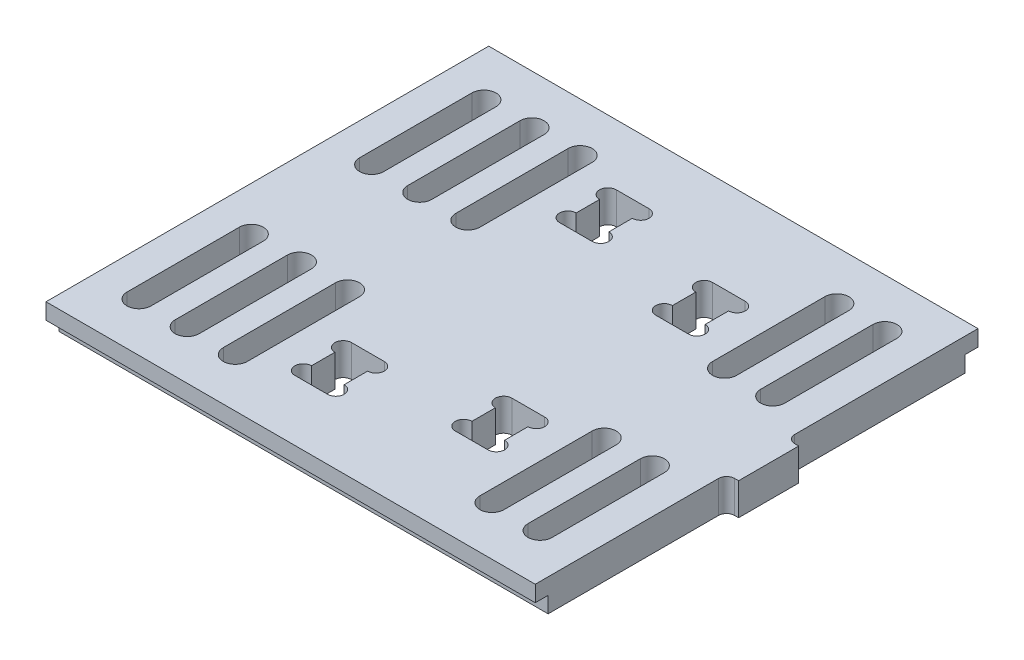
from build123d import *

# Parameters (mm, degrees)
SKETCH1_W           = 175.26
SKETCH1_H           = 12.7
BOSS_EXTRUDE1_DEPTH = 96.8375
SKETCH2_W           = 5.08
SKETCH2_H           = 6.35
CUT_EXTRUDE1_DEPTH  = 213.67191875
CUT_EXTRUDE2_DEPTH  = 132.216646453
CUT_EXTRUDE3_DEPTH  = 132.216646453
SKETCH5_W           = 4.7625
SKETCH5_H           = 23.8125
BOSS_EXTRUDE2_DEPTH = 12.7
FILLET1_R           = 3.175


with BuildPart() as part:
    # Sketch1 → Boss-Extrude1 (new, symmetric)
    with BuildSketch(Plane(origin=(0, 0, 0), x_dir=(0, 0, -1), z_dir=(1, 0, 0))):
        Rectangle(SKETCH1_W, SKETCH1_H)
    extrude(amount=BOSS_EXTRUDE1_DEPTH, both=True)

    # Sketch2 → Cut-Extrude1 (cut, through all)
    with BuildSketch(Plane(origin=(96.8375, 0, 0), x_dir=(0, 0, -1), z_dir=(1, 0, 0))):
        with Locations((-85.09, -3.175)):
            Rectangle(SKETCH2_W, SKETCH2_H)
        with Locations((85.09, -3.175)):
            Rectangle(SKETCH2_W, SKETCH2_H)
    extrude(amount=-CUT_EXTRUDE1_DEPTH, mode=Mode.SUBTRACT)

    # Sketch3 → Cut-Extrude2 (cut, through all)
    with BuildSketch(Plane(origin=(0, 6.35, 0), x_dir=(1, 0, 0), z_dir=(0, 1, 0))):
        with BuildLine():
            Line((28.448, -28.448), (41.402, -28.448))
            ThreePointArc((41.402, -28.448), (44.704, -31.75), (41.402, -35.052))
            Line((41.402, -35.052), (41.402, -44.323))
            ThreePointArc((41.402, -44.323), (44.704, -47.625), (41.402, -50.927))
            Line((41.402, -50.927), (28.448, -50.927))
            ThreePointArc((28.448, -50.927), (25.146, -47.625), (28.448, -44.323))
            Line((28.448, -44.323), (28.448, -35.052))
            ThreePointArc((28.448, -35.052), (25.146, -31.75), (28.448, -28.448))
        make_face()
        with BuildLine():
            Line((-22.352, -41.148), (-9.398, -41.148))
            ThreePointArc((-9.398, -41.148), (-6.096, -44.45), (-9.398, -47.752))
            Line((-9.398, -47.752), (-9.398, -57.023))
            ThreePointArc((-9.398, -57.023), (-6.096, -60.325), (-9.398, -63.627))
            Line((-9.398, -63.627), (-22.352, -63.627))
            ThreePointArc((-22.352, -63.627), (-25.654, -60.325), (-22.352, -57.023))
            Line((-22.352, -57.023), (-22.352, -47.752))
            ThreePointArc((-22.352, -47.752), (-25.654, -44.45), (-22.352, -41.148))
        make_face()
        with BuildLine():
            Line((-9.398, 47.752), (-9.398, 57.023))
            ThreePointArc((-9.398, 57.023), (-6.096, 60.325), (-9.398, 63.627))
            Line((-9.398, 63.627), (-22.352, 63.627))
            ThreePointArc((-22.352, 63.627), (-25.654, 60.325), (-22.352, 57.023))
            Line((-22.352, 57.023), (-22.352, 47.752))
            ThreePointArc((-22.352, 47.752), (-25.654, 44.45), (-22.352, 41.148))
            Line((-22.352, 41.148), (-9.398, 41.148))
            ThreePointArc((-9.398, 41.148), (-6.096, 44.45), (-9.398, 47.752))
        make_face()
        with BuildLine():
            Line((41.402, 35.052), (41.402, 44.323))
            ThreePointArc((41.402, 44.323), (44.704, 47.625), (41.402, 50.927))
            Line((41.402, 50.927), (28.448, 50.927))
            ThreePointArc((28.448, 50.927), (25.146, 47.625), (28.448, 44.323))
            Line((28.448, 44.323), (28.448, 35.052))
            ThreePointArc((28.448, 35.052), (25.146, 31.75), (28.448, 28.448))
            Line((28.448, 28.448), (41.402, 28.448))
            ThreePointArc((41.402, 28.448), (44.704, 31.75), (41.402, 35.052))
        make_face()
    extrude(amount=-CUT_EXTRUDE2_DEPTH, mode=Mode.SUBTRACT)

    # Sketch4 → Cut-Extrude3 (cut, through all)
    with BuildSketch(Plane(origin=(0, 6.35, 0), x_dir=(1, 0, 0), z_dir=(0, 1, 0))):
        with BuildLine():
            Line((55.5625, -68.2625), (55.5625, -23.8125))
            ThreePointArc((55.5625, -23.8125), (60.325, -19.05), (65.0875, -23.8125))
            Line((65.0875, -23.8125), (65.0875, -68.2625))
            ThreePointArc((65.0875, -68.2625), (60.325, -73.025), (55.5625, -68.2625))
        make_face()
        with BuildLine():
            Line((55.5625, 23.8125), (55.5625, 68.2625))
            ThreePointArc((55.5625, 68.2625), (60.325, 73.025), (65.0875, 68.2625))
            Line((65.0875, 68.2625), (65.0875, 23.8125))
            ThreePointArc((65.0875, 23.8125), (60.325, 19.05), (55.5625, 23.8125))
        make_face()
        with BuildLine():
            Line((84.1375, 68.2625), (84.1375, 23.8125))
            ThreePointArc((84.1375, 23.8125), (79.375, 19.05), (74.6125, 23.8125))
            Line((74.6125, 23.8125), (74.6125, 68.2625))
            ThreePointArc((74.6125, 68.2625), (79.375, 73.025), (84.1375, 68.2625))
        make_face()
        with BuildLine():
            Line((84.1375, -23.8125), (84.1375, -68.2625))
            ThreePointArc((84.1375, -68.2625), (79.375, -73.025), (74.6125, -68.2625))
            Line((74.6125, -68.2625), (74.6125, -23.8125))
            ThreePointArc((74.6125, -23.8125), (79.375, -19.05), (84.1375, -23.8125))
        make_face()
        with BuildLine():
            Line((-84.1375, -68.2625), (-84.1375, -23.8125))
            ThreePointArc((-84.1375, -23.8125), (-79.375, -19.05), (-74.6125, -23.8125))
            Line((-74.6125, -23.8125), (-74.6125, -68.2625))
            ThreePointArc((-74.6125, -68.2625), (-79.375, -73.025), (-84.1375, -68.2625))
        make_face()
        with BuildLine():
            Line((-84.1375, 23.8125), (-84.1375, 68.2625))
            ThreePointArc((-84.1375, 68.2625), (-79.375, 73.025), (-74.6125, 68.2625))
            Line((-74.6125, 68.2625), (-74.6125, 23.8125))
            ThreePointArc((-74.6125, 23.8125), (-79.375, 19.05), (-84.1375, 23.8125))
        make_face()
        with BuildLine():
            Line((-65.0875, -68.2625), (-65.0875, -23.8125))
            ThreePointArc((-65.0875, -23.8125), (-60.325, -19.05), (-55.5625, -23.8125))
            Line((-55.5625, -23.8125), (-55.5625, -68.2625))
            ThreePointArc((-55.5625, -68.2625), (-60.325, -73.025), (-65.0875, -68.2625))
        make_face()
        with BuildLine():
            Line((-65.0875, 23.8125), (-65.0875, 68.2625))
            ThreePointArc((-65.0875, 68.2625), (-60.325, 73.025), (-55.5625, 68.2625))
            Line((-55.5625, 68.2625), (-55.5625, 23.8125))
            ThreePointArc((-55.5625, 23.8125), (-60.325, 19.05), (-65.0875, 23.8125))
        make_face()
        with BuildLine():
            Line((-46.0375, -68.2625), (-46.0375, -23.8125))
            ThreePointArc((-46.0375, -23.8125), (-41.275, -19.05), (-36.5125, -23.8125))
            Line((-36.5125, -23.8125), (-36.5125, -68.2625))
            ThreePointArc((-36.5125, -68.2625), (-41.275, -73.025), (-46.0375, -68.2625))
        make_face()
        with BuildLine():
            Line((-46.0375, 23.8125), (-46.0375, 68.2625))
            ThreePointArc((-46.0375, 68.2625), (-41.275, 73.025), (-36.5125, 68.2625))
            Line((-36.5125, 68.2625), (-36.5125, 23.8125))
            ThreePointArc((-36.5125, 23.8125), (-41.275, 19.05), (-46.0375, 23.8125))
        make_face()
    extrude(amount=-CUT_EXTRUDE3_DEPTH, mode=Mode.SUBTRACT)

    # Sketch5 → Boss-Extrude2 (add)
    with BuildSketch(Plane(origin=(0, 6.35, 0), x_dir=(1, 0, 0), z_dir=(0, 1, 0))):
        with Locations((99.21875, 0)):
            Rectangle(SKETCH5_W, SKETCH5_H)
    extrude(amount=-BOSS_EXTRUDE2_DEPTH)

    # Fillet1
    fillet1_edges = [part.edges().sort_by_distance(p)[0] for p in [
        (96.8375, 0, 11.90625),
        (96.8375, 0, -11.90625),
    ]]
    fillet(fillet1_edges, radius=FILLET1_R)


solid = part.part
